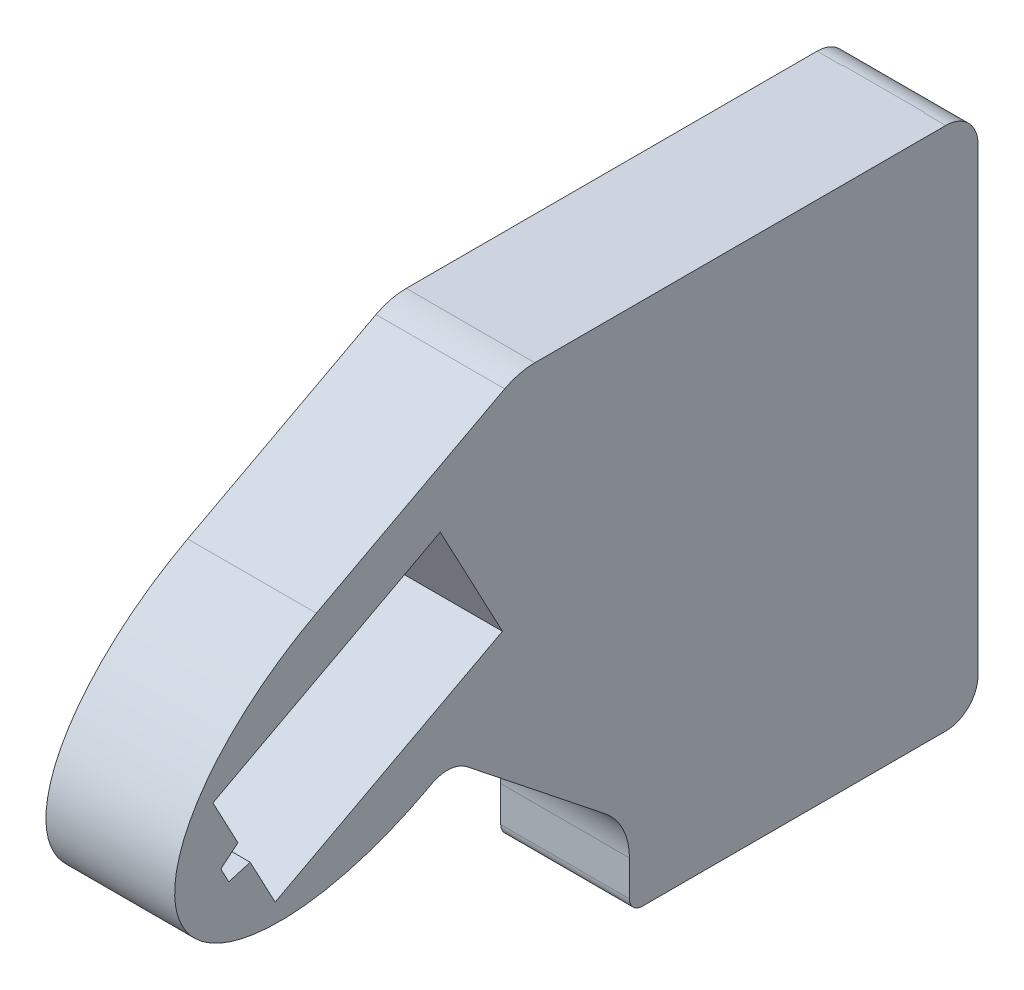
from build123d import *

# Parameters (mm, degrees)
EXTRUDE_1_DEPTH          = 20
CUT_EXTRUDE_2_DEPTH      = 20
SKETCH_1_12_R            = 1.8
CUT_EXTRUDE_3_DEPTH      = 11
CUT_EXTRUDE_5_DEPTH      = 136.4704716
CUT_EXTRUDE_5_DEPTH_BACK = 136.4704716
SKETCH_3_R               = 1.6
SKETCH_5_W               = 12.65769882
SKETCH_5_H               = 46.583877405
EXTRUDE_5_DEPTH          = 9.128947


with BuildPart() as part:
    # 草图1 → 凸台-拉伸1 (new body)
    with BuildSketch(Plane(origin=(0, 0, 0), x_dir=(0, 0, -1), z_dir=(1, 0, 0))):
        with BuildLine():
            Line((58.605640082, -64.854110761), (58.605640082, -70.36393759))
            ThreePointArc((58.605640082, -70.36393759), (59.19142652, -71.778151152), (60.605640082, -72.36393759))
            Line((60.605640082, -72.36393759), (107.763953331, -72.36393759))
            ThreePointArc((107.763953331, -72.36393759), (111.299487237, -70.899471496), (112.763953331, -67.36393759))
            Line((112.763953331, -67.36393759), (112.763953331, 4.12894742))
            ThreePointArc((112.763953331, 4.12894742), (111.299487237, 7.664481326), (107.763953331, 9.12894742))
            Line((107.763953331, 9.12894742), (43.916260913, 9.12894742))
            ThreePointArc((43.916260913, 9.12894742), (41.497041957, 8.831904682), (39.221545285, 7.958423348))
            Line((39.221545285, 7.958423348), (9.959078206, -7.600706391))
            add(Edge.make_bspline(
                [(9.959078206, -7.600706391), (-19.420707738, -23.222215678), (-10.829378139, -39.380156627), (-2.23804854, -55.538097577), (27.141737404, -39.91658829)],
                knots=[4.71238898, 4.71238898, 4.71238898, 6.283185307, 6.283185307, 7.853981634, 7.853981634, 7.853981634], degree=2, weights=[1, 0.707106781, 1, 0.707106781, 1]))
            Line((27.141737404, -39.91658829), (27.938173606, -39.49311565))
            ThreePointArc((27.938173606, -39.49311565), (30.741964236, -38.928730289), (33.396414198, -39.993468817))
            Line((33.396414198, -39.993468817), (54.827405639, -57.025341167))
            ThreePointArc((54.827405639, -57.025341167), (57.611684041, -60.507713148), (58.605640082, -64.854110761))
        make_face()
    extrude(amount=EXTRUDE_1_DEPTH)

    # 草图1<11> → 切除-拉伸2 (cut)
    with BuildSketch(Plane(origin=(0, 0, 0), x_dir=(0, 0, -1), z_dir=(1, 0, 0))):
        Polygon((-6.115071551, -25.08624568), (-2.232372323, -32.388540875), (-4.891184355, -34.599728538), (-3.646603058, -36.940445521), (-0.326656585, -35.972670897), (3.556042643, -43.274966093), (38.873946357, -24.496103581), (29.202832164, -6.307383168), align=None)
    extrude(amount=CUT_EXTRUDE_2_DEPTH, mode=Mode.SUBTRACT)

    # 草图1<12> → 切除-拉伸3 (cut)
    with BuildSketch(Plane(origin=(0, 0, 0), x_dir=(0, 0, -1), z_dir=(1, 0, 0))):
        with Locations((39.917537446, -17.938595088)):
            Circle(SKETCH_1_12_R)
        with Locations((-6.61625152, -31.355349065)):
            Circle(SKETCH_1_12_R)
        with Locations(Location((-1.921535892, -40.184824994, 0), (0, 0, 180))):
            Circle(SKETCH_1_12_R)
        with Locations(Location((35.222821818, -9.109119159, 0), (0, 0, 180))):
            Circle(SKETCH_1_12_R)
    extrude(amount=CUT_EXTRUDE_3_DEPTH, mode=Mode.SUBTRACT)

    # 草图3 → 切除-拉伸5 (cut, two sides: drawn at the far end of the back side and taken through both)
    with BuildSketch(Plane(origin=(0, 0, 0), x_dir=(1, 0, 0), z_dir=(0, 1, 0)).offset(-CUT_EXTRUDE_5_DEPTH_BACK)):
        with Locations(Location((10, 102.763953331, 0), (0, 0, 270))):
            Circle(SKETCH_3_R)
        with Locations(Location((10, 92.763953331, 0), (0, 0, 270))):
            Circle(SKETCH_3_R)
        with Locations(Location((10, 82.763953331, 0), (0, 0, 270))):
            Circle(SKETCH_3_R)
        with Locations(Location((10, 72.763953331, 0), (0, 0, 270))):
            Circle(SKETCH_3_R)
        with Locations(Location((10, 64.763953331, 0), (0, 0, 270))):
            Circle(SKETCH_3_R)
    extrude(amount=CUT_EXTRUDE_5_DEPTH + CUT_EXTRUDE_5_DEPTH_BACK, mode=Mode.SUBTRACT)

    # 草图5 → 凸台-拉伸5 (add)
    with BuildSketch(Plane(origin=(0, 0, 0), x_dir=(1, 0, 0), z_dir=(0, 1, 0))):
        with Locations((10.284635372, 84.574401096)):
            Rectangle(SKETCH_5_W, SKETCH_5_H)
    extrude(amount=EXTRUDE_5_DEPTH)


solid = part.part
